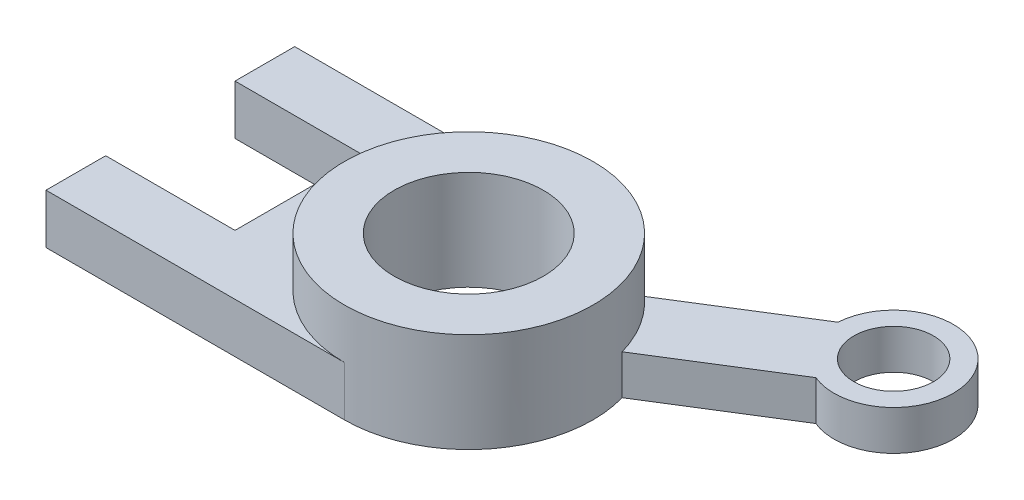
from build123d import *

# Parameters (mm, degrees)
SKETCH_1_R      = 7.5
EXTRUDE_1_DEPTH = 10
EXTRUDE_3_DEPTH = 5
SKETCH_1_5_R    = 4
EXTRUDE_4_DEPTH = 4


with BuildPart() as part:
    # 草图1 → 凸台-拉伸1 (new body)
    with BuildSketch(Plane(origin=(0, 0, 0), x_dir=(1, 0, 0), z_dir=(0, 1, 0))):
        with BuildLine():
            ThreePointArc((12.031294579, 3.390862834), (10.600601202, 6.623990803), (8.321859729, 9.327199507))
            ThreePointArc((8.321859729, 9.327199507), (4.453089161, 11.679897128), (0, 12.5))
            ThreePointArc((0, 12.5), (-12.5, 0), (0, -12.5))
            ThreePointArc((0, -12.5), (8.838834765, -8.838834765), (12.5, 0))
            ThreePointArc((12.5, 0), (12.382269223, 1.711551601), (12.031294579, 3.390862834))
        make_face()
        Circle(SKETCH_1_R, mode=Mode.SUBTRACT)
    extrude(amount=EXTRUDE_1_DEPTH)

    # 草图1<4> → 凸台-拉伸3 (add)
    with BuildSketch(Plane(origin=(0, 0, 0), x_dir=(1, 0, 0), z_dir=(0, 1, 0))):
        with BuildLine():
            ThreePointArc((0, -12.5), (-12.5, 0), (0, 12.5))
            Line((0, 12.5), (-30, 12.5))
            Line((-30, 12.5), (-30, 6.5))
            Line((-30, 6.5), (-17, 6.5))
            Line((-17, 6.5), (-17, -6.5))
            Line((-17, -6.5), (-30, -6.5))
            Line((-30, -6.5), (-30, -12.5))
            Line((-30, -12.5), (0, -12.5))
        make_face()
    extrude(amount=EXTRUDE_3_DEPTH)

    # 草图1<5> → 凸台-拉伸4 (add)
    with BuildSketch(Plane(origin=(0, 0, 0), x_dir=(1, 0, 0), z_dir=(0, 1, 0))):
        with BuildLine():
            Line((20.301898362, 16.813158484), (8.321859729, 9.327199507))
            ThreePointArc((8.321859729, 9.327199507), (10.600601202, 6.623990803), (12.031294579, 3.390862834))
            Line((12.031294579, 3.390862834), (24.011333212, 10.876821811))
            ThreePointArc((24.011333212, 10.876821811), (31.377779558, 19.607012777), (20.301898362, 16.813158484))
        make_face()
        with Locations((26.289490981, 16.427497191)):
            Circle(SKETCH_1_5_R, mode=Mode.SUBTRACT)
    extrude(amount=EXTRUDE_4_DEPTH)


solid = part.part
